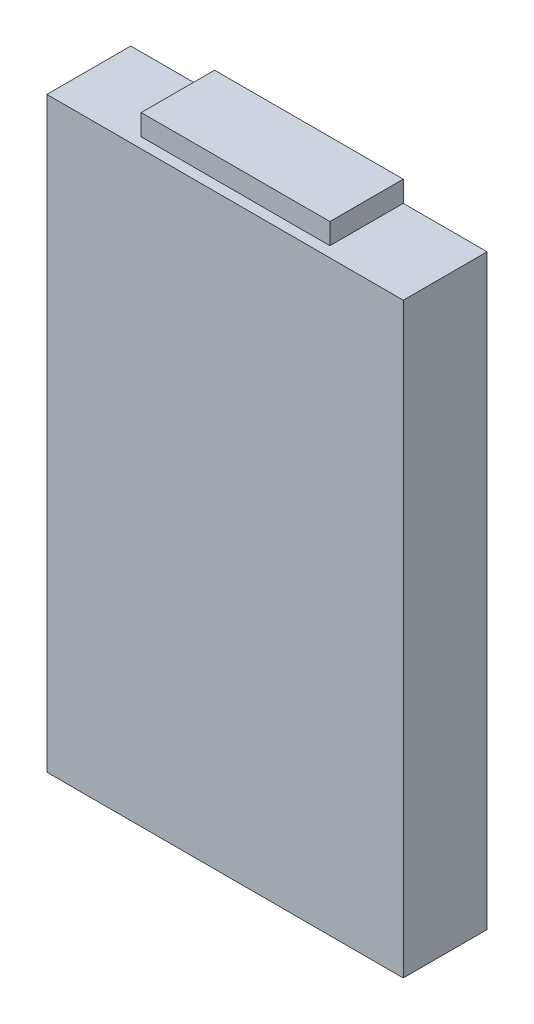
from build123d import *

# Parameters (mm, degrees)
SKETCH1_W           = 17
SKETCH1_H           = 28
BOSS_EXTRUDE1_DEPTH = 4
SKETCH2_W           = 9
SKETCH2_H           = 3.5
BOSS_EXTRUDE2_DEPTH = 1


with BuildPart() as part:
    # Sketch1 → Boss-Extrude1 (new body)
    with BuildSketch(Plane.XY):
        with Locations((8.5, 14)):
            Rectangle(SKETCH1_W, SKETCH1_H)
    extrude(amount=BOSS_EXTRUDE1_DEPTH)

    # Sketch2 → Boss-Extrude2 (add)
    with BuildSketch(Plane(origin=(0, 28, 0), x_dir=(1, 0, 0), z_dir=(0, 1, 0))):
        with Locations((8.5, -1.75)):
            Rectangle(SKETCH2_W, SKETCH2_H)
    extrude(amount=BOSS_EXTRUDE2_DEPTH)


solid = part.part
